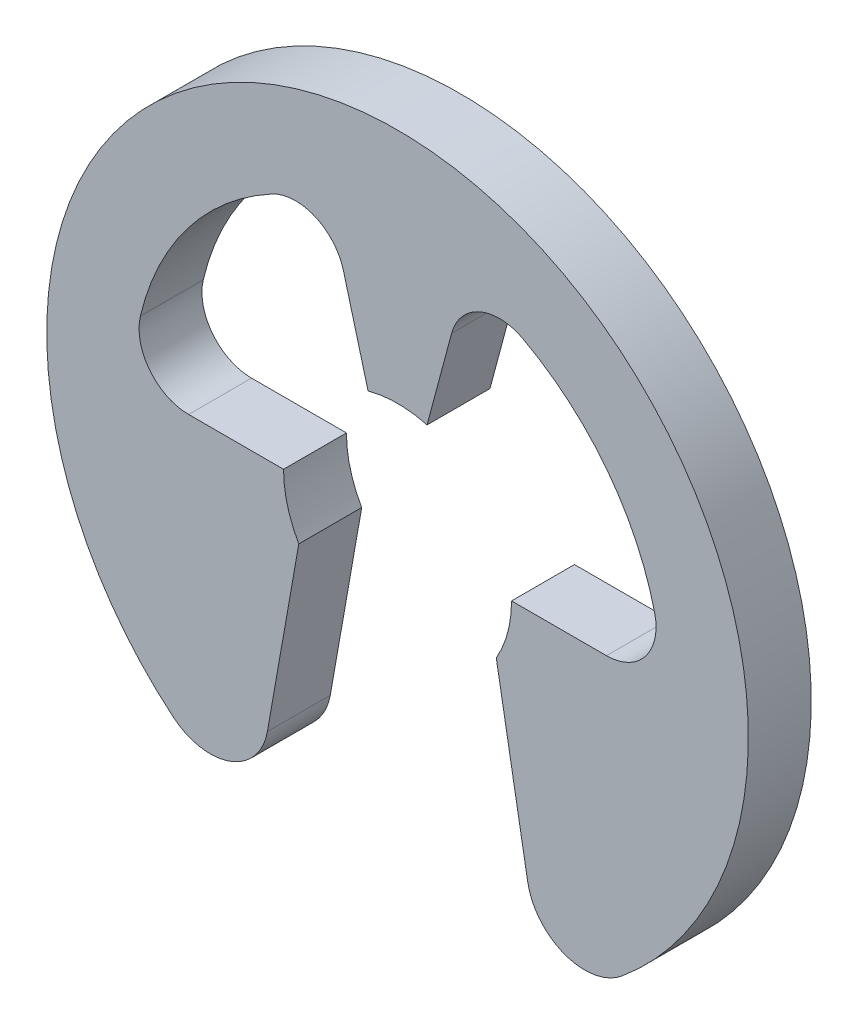
from build123d import *

# Parameters (mm, degrees)
BODY_DEPTH = 0.4


with BuildPart() as part:
    # BodySke → Body (new body)
    with BuildSketch(Plane.XY):
        with BuildLine():
            Line((0.627868418, -0.3625), (0.827723046, -1.495931917))
            ThreePointArc((0.827723046, -1.495931917), (1.063813027, -1.777935409), (1.426221788, -1.715290871))
            ThreePointArc((1.426221788, -1.715290871), (0, 2.230769231), (-1.426221788, -1.715290871))
            ThreePointArc((-1.426221788, -1.715290871), (-1.063813027, -1.777935409), (-0.827723046, -1.495931917))
            Line((-0.827723046, -1.495931917), (-0.627868418, -0.3625))
            ThreePointArc((-0.627868418, -0.3625), (-0.700296224, -0.187643808), (-0.725, 0))
            Line((-0.725, 0), (-1.328436317, 0))
            ThreePointArc((-1.328436317, 0), (-1.575882972, 0.119828441), (-1.635309428, 0.388263161))
            ThreePointArc((-1.635309428, 0.388263161), (-1.333443883, 1.023187479), (-0.798282639, 1.47909771))
            ThreePointArc((-0.798282639, 1.47909771), (-0.523613912, 1.491172179), (-0.343824619, 1.283170947))
            Line((-0.343824619, 1.283170947), (-0.187643808, 0.700296224))
            ThreePointArc((-0.187643808, 0.700296224), (0, 0.725), (0.187643808, 0.700296224))
            Line((0.187643808, 0.700296224), (0.343824619, 1.283170947))
            ThreePointArc((0.343824619, 1.283170947), (0.523613912, 1.491172179), (0.798282639, 1.47909771))
            ThreePointArc((0.798282639, 1.47909771), (1.333443883, 1.023187479), (1.635309428, 0.388263161))
            ThreePointArc((1.635309428, 0.388263161), (1.575882972, 0.119828441), (1.328436317, 0))
            Line((1.328436317, 0), (0.725, 0))
            ThreePointArc((0.725, 0), (0.700296224, -0.187643808), (0.627868418, -0.3625))
        make_face()
    extrude(amount=-BODY_DEPTH)


solid = part.part
